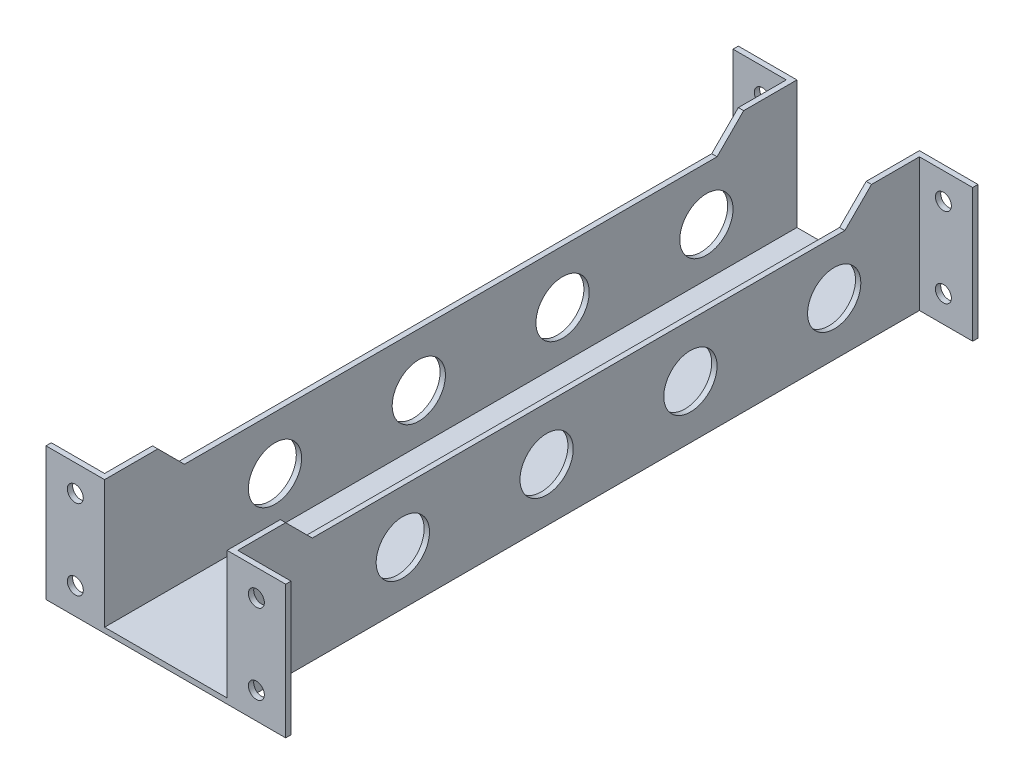
from build123d import *

# Parameters (mm, degrees)
SKETCH1_W               = 25
SKETCH1_H               = 130
BOSS_EXTRUDE1_DEPTH     = 1
SKETCH2_W               = 1
SKETCH2_H               = 130
BOSS_EXTRUDE2_DEPTH     = 24
SKETCH3_W               = 1
SKETCH3_H               = 25
BOSS_EXTRUDE3_DEPTH     = 10
SKETCH4_W               = 1
SKETCH4_H               = 25
BOSS_EXTRUDE4_DEPTH     = 10
SKETCH5_R               = 5
CUT_EXTRUDE1_DEPTH      = 73.850875081
SKETCH10_R              = 1.5
CUT_EXTRUDE3_DEPTH      = 135.28049002
CUT_EXTRUDE4_DEPTH      = 78.942286341
CUT_EXTRUDE4_DEPTH_BACK = 78.942286341
SKETCH9_R               = 5
CUT_EXTRUDE2_DEPTH      = 78.942286341


with BuildPart() as part:
    # Sketch1 → Boss-Extrude1 (new body)
    with BuildSketch(Plane(origin=(0, 0, 0), x_dir=(1, 0, 0), z_dir=(0, 1, 0))):
        Rectangle(SKETCH1_W, SKETCH1_H)
    extrude(amount=BOSS_EXTRUDE1_DEPTH)

    # Sketch2 → Boss-Extrude2 (add)
    with BuildSketch(Plane(origin=(0, 1, 0), x_dir=(1, 0, 0), z_dir=(0, 1, 0))):
        with Locations((12, 0)):
            Rectangle(SKETCH2_W, SKETCH2_H)
        with Locations((-12, 0)):
            Rectangle(SKETCH2_W, SKETCH2_H)
    extrude(amount=BOSS_EXTRUDE2_DEPTH)

    # Sketch3 → Boss-Extrude3 (add)
    with BuildSketch(Plane(origin=(12.5, 0, 0), x_dir=(0, 0, -1), z_dir=(1, 0, 0))):
        with Locations((-64.5, 12.5)):
            Rectangle(SKETCH3_W, SKETCH3_H)
        with Locations((64.5, 12.5)):
            Rectangle(SKETCH3_W, SKETCH3_H)
    extrude(amount=BOSS_EXTRUDE3_DEPTH)

    # Sketch4 → Boss-Extrude4 (add)
    with BuildSketch(Plane.ZY.offset(12.5)):
        with Locations((-64.5, 12.5)):
            Rectangle(SKETCH4_W, SKETCH4_H)
        with Locations((64.5, 12.5)):
            Rectangle(SKETCH4_W, SKETCH4_H)
    extrude(amount=BOSS_EXTRUDE4_DEPTH)

    # Sketch5 → Cut-Extrude1 (cut, through all)
    with BuildSketch(Plane(origin=(0, 1, 0), x_dir=(1, 0, 0), z_dir=(0, 1, 0))):
        with Locations(Location((0, -33, 0), (0, 0, 270))):
            Circle(SKETCH5_R)
        with Locations(Location((0, -6, 0), (0, 0, 270))):
            Circle(SKETCH5_R)
        with Locations(Location((0, 21, 0), (0, 0, 270))):
            Circle(SKETCH5_R)
        with Locations(Location((0, 48, 0), (0, 0, 270))):
            Circle(SKETCH5_R)
    extrude(amount=-CUT_EXTRUDE1_DEPTH, mode=Mode.SUBTRACT)

    # Sketch10 → Cut-Extrude3 (cut, through all)
    with BuildSketch(Plane.XY.offset(65)):
        with Locations((17, 20)):
            Circle(SKETCH10_R)
        with Locations((17, 5)):
            Circle(SKETCH10_R)
        with Locations((-17, 20)):
            Circle(SKETCH10_R)
        with Locations((-17, 5)):
            Circle(SKETCH10_R)
    extrude(amount=-CUT_EXTRUDE3_DEPTH, mode=Mode.SUBTRACT)

    # Sketch11 → Cut-Extrude4 (cut, two sides: drawn at the far end of the back side and taken through both)
    with BuildSketch(Plane(origin=(12.5, 0, 0), x_dir=(0, 0, -1), z_dir=(1, 0, 0)).offset(-CUT_EXTRUDE4_DEPTH_BACK)):
        Polygon((0, 25), (-55, 25), (-50, 20), (0, 20), align=None)
        Polygon((55, 25), (0, 25), (0, 20), (50, 20), align=None)
    extrude(amount=CUT_EXTRUDE4_DEPTH + CUT_EXTRUDE4_DEPTH_BACK, mode=Mode.SUBTRACT)

    # Sketch9 → Cut-Extrude2 (cut, through all)
    with BuildSketch(Plane(origin=(12.5, 0, 0), x_dir=(0, 0, -1), z_dir=(1, 0, 0))):
        with Locations((-33, 10)):
            Circle(SKETCH9_R)
        with Locations((-6, 10)):
            Circle(SKETCH9_R)
        with Locations((21, 10)):
            Circle(SKETCH9_R)
        with Locations((48, 10)):
            Circle(SKETCH9_R)
    extrude(amount=-CUT_EXTRUDE2_DEPTH, mode=Mode.SUBTRACT)


solid = part.part
